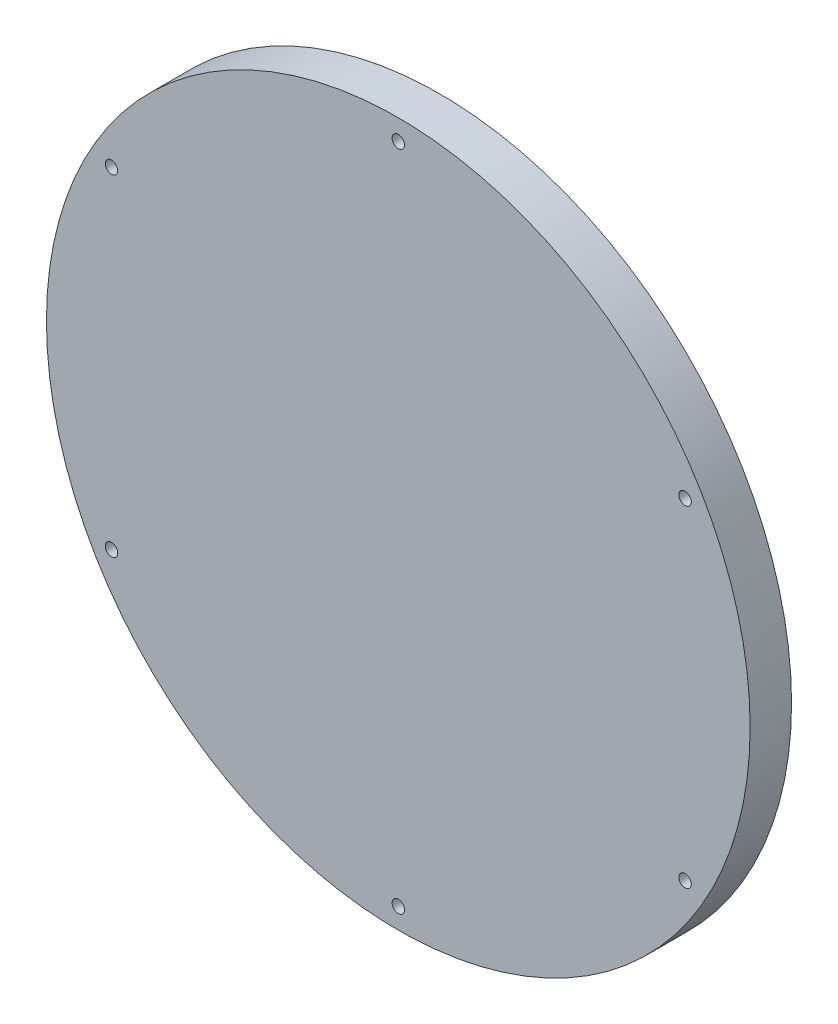
from build123d import *

# Parameters (mm, degrees)
SKETCH1_R           = 85
SKETCH1_R_2         = 1.5
BOSS_EXTRUDE1_DEPTH = 10
BOSS_EXTRUDE2_DEPTH = 5


with BuildPart() as part:
    # Sketch1 → Boss-Extrude1 (new body)
    with BuildSketch(Plane.XY):
        Circle(SKETCH1_R)
        with Locations((0, 80)):
            Circle(SKETCH1_R_2, mode=Mode.SUBTRACT)
        with Locations((69.282032303, 40)):
            Circle(SKETCH1_R_2, mode=Mode.SUBTRACT)
        with Locations((69.282032303, -40)):
            Circle(SKETCH1_R_2, mode=Mode.SUBTRACT)
        with Locations((0, -80)):
            Circle(SKETCH1_R_2, mode=Mode.SUBTRACT)
        with Locations((-69.282032303, -40)):
            Circle(SKETCH1_R_2, mode=Mode.SUBTRACT)
        with Locations((-69.282032303, 40)):
            Circle(SKETCH1_R_2, mode=Mode.SUBTRACT)
    extrude(amount=BOSS_EXTRUDE1_DEPTH)

    # Sketch2 → Boss-Extrude2 (add, symmetric)
    with BuildSketch(Plane(origin=(0, 0, 0), x_dir=(1, 0, 0), z_dir=(0, 1, 0))):
        Polygon((-50, 0), (-45, 0), (-45, 2), (45, 2), (45, 0), (50, 0), (50, 4), (-50, 4), align=None)
    extrude(amount=BOSS_EXTRUDE2_DEPTH, both=True)


solid = part.part
